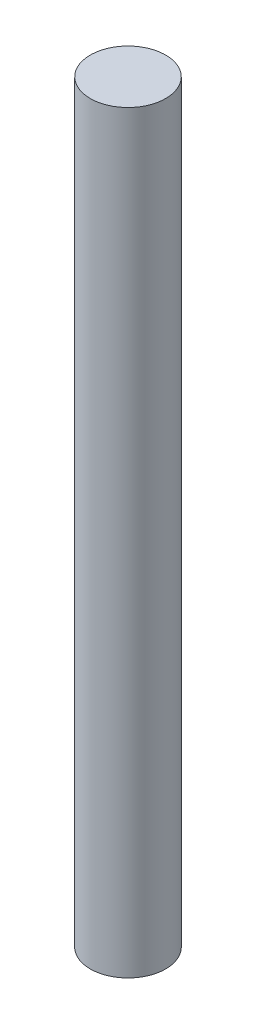
from build123d import *

# Parameters (mm, degrees)
CROQUIS1_R              = 0.35
SALIENTE_EXTRUIR1_DEPTH = 7


with BuildPart() as part:
    # Croquis1 → Saliente-Extruir1 (new body)
    with BuildSketch(Plane(origin=(0, 0, 0), x_dir=(1, 0, 0), z_dir=(0, 1, 0))):
        with Locations(Location((0, 0, 0), (0, 0, 270))):
            Circle(CROQUIS1_R)
    extrude(amount=SALIENTE_EXTRUIR1_DEPTH)


solid = part.part
